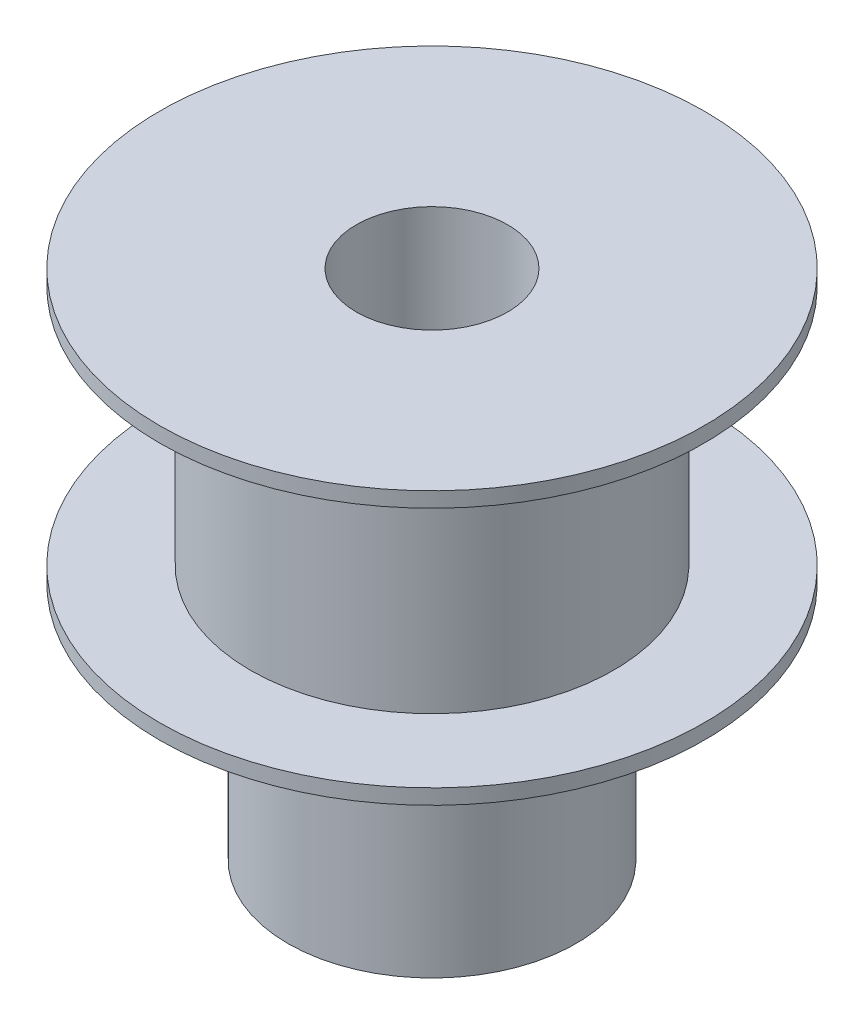
from build123d import *

# Parameters (mm, degrees)
SKETCH1_R           = 4.7625
SKETCH1_R_2         = 2.5
BOSS_EXTRUDE1_DEPTH = 3.96875
SKETCH2_R           = 9
SKETCH2_R_2         = 2.5
BOSS_EXTRUDE2_DEPTH = 9
SKETCH3_W           = 3
SKETCH3_H           = 8


with BuildPart() as part:
    # Sketch1 → Boss-Extrude1 (new, symmetric)
    with BuildSketch(Plane(origin=(0, 0, 0), x_dir=(1, 0, 0), z_dir=(0, 1, 0))):
        with Locations(Location((0, 0, 0), (0, 0, 270))):
            Circle(SKETCH1_R)
        with Locations(Location((0, 0, 0), (0, 0, 270))):
            Circle(SKETCH1_R_2, mode=Mode.SUBTRACT)
    extrude(amount=BOSS_EXTRUDE1_DEPTH, both=True)

    # Sketch2 → Boss-Extrude2 (add)
    with BuildSketch(Plane(origin=(0, 3.96875, 0), x_dir=(1, 0, 0), z_dir=(0, 1, 0))):
        with Locations(Location((0, 0, 0), (0, 0, 270))):
            Circle(SKETCH2_R)
        with Locations(Location((0, 0, 0), (0, 0, 270))):
            Circle(SKETCH2_R_2, mode=Mode.SUBTRACT)
    extrude(amount=BOSS_EXTRUDE2_DEPTH)

    # Sketch3 → Cut-Revolve1 (revolve, cut)
    with BuildSketch(Plane(origin=(0, 0, 0), x_dir=(0, 0, -1), z_dir=(1, 0, 0)), mode=Mode.PRIVATE) as cut_revolve1_sk:
        with Locations((7.5, 8.46875)):
            Rectangle(SKETCH3_W, SKETCH3_H)
    revolve(cut_revolve1_sk.sketch.rotate(Axis((0, 3.96875, 0), (0, -1, 0)), 180), axis=Axis((0, 3.96875, 0), (0, -1, 0)), mode=Mode.SUBTRACT)


solid = part.part
